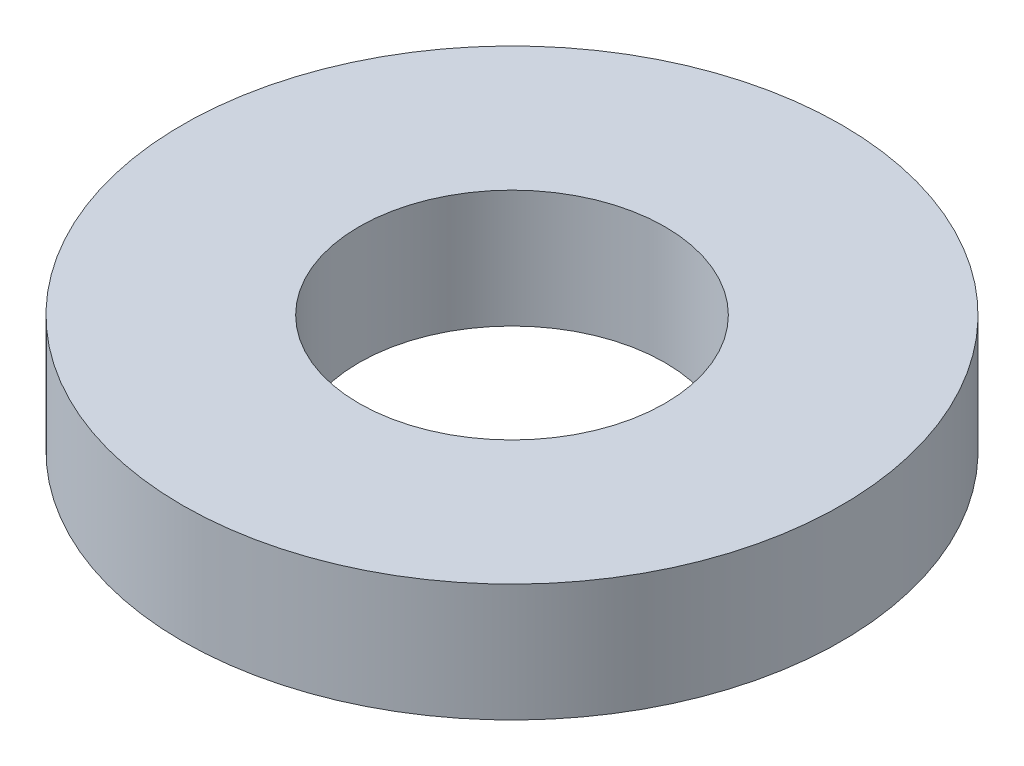
from build123d import *

# Parameters (mm, degrees)
ESQUISSE1_R        = 5.6
ESQUISSE1_R_2      = 2.6
BOSS_EXTRU_1_DEPTH = 2


with BuildPart() as part:
    # Esquisse1 → Boss.-Extru.1 (new body)
    with BuildSketch(Plane(origin=(0, 0, 0), x_dir=(1, 0, 0), z_dir=(0, 1, 0))):
        with Locations(Location((0, 0, 0), (0, 0, 270))):
            Circle(ESQUISSE1_R)
        with Locations(Location((0, 0, 0), (0, 0, 270))):
            Circle(ESQUISSE1_R_2, mode=Mode.SUBTRACT)
    extrude(amount=BOSS_EXTRU_1_DEPTH)


solid = part.part
